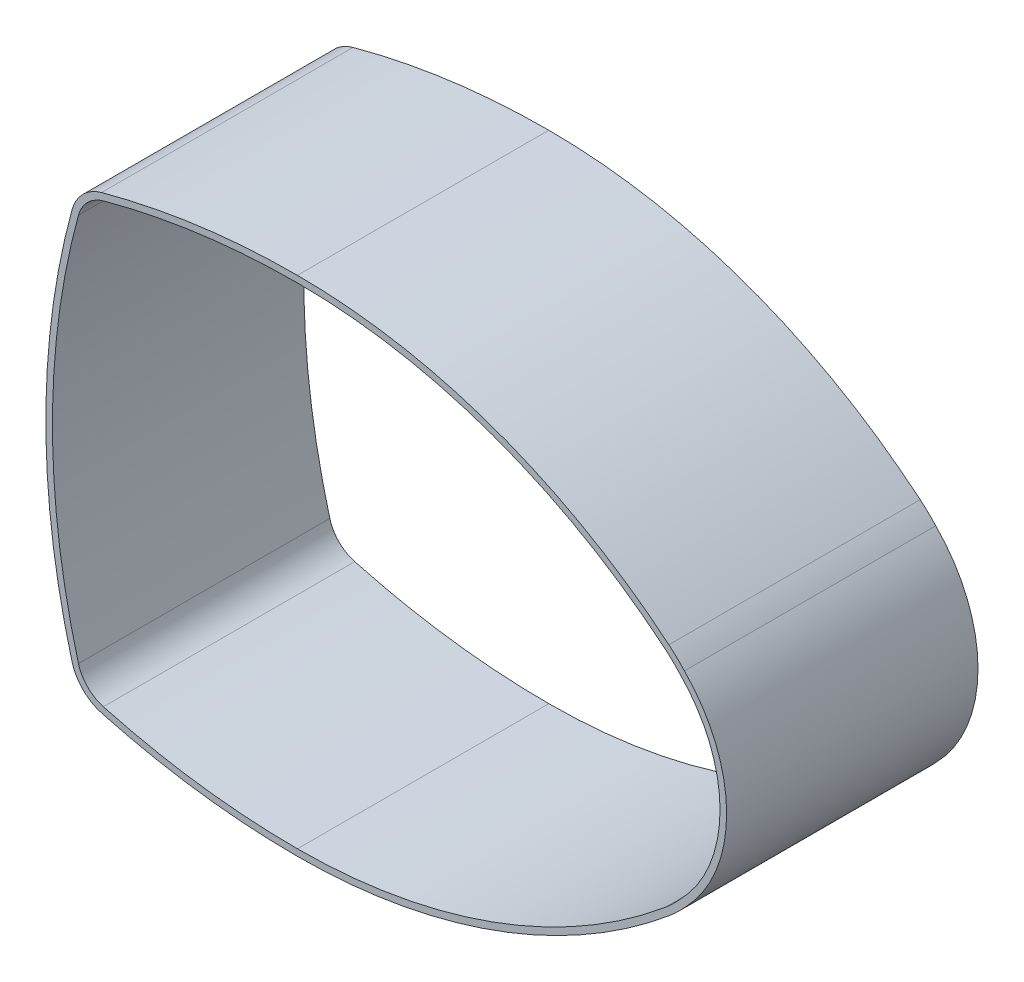
from build123d import *

# Parameters (mm, degrees)
EXTRUDE_1_DEPTH = 38.1


with BuildPart() as part:
    # Эскиз1 → Бобышка-Вытянуть1 (new body)
    with BuildSketch(Plane.XY):
        with BuildLine():
            ThreePointArc((58.039129224, 77.945655108), (56.901327597, 79.116004883), (55.683853915, 80.203234837))
            ThreePointArc((55.683853915, 80.203234837), (29.318529457, 95.307848832), (-0.611231214, 100.550855968))
            ThreePointArc((-0.611231214, 100.550855968), (-15.584507099, 99.552637576), (-30.292769251, 96.575649981))
            ThreePointArc((-30.292769251, 96.575649981), (-33.129887493, 94.929167254), (-34.776370221, 92.092049011))
            ThreePointArc((-34.776370221, 92.092049011), (-38.751576208, 62.410510975), (-34.776370221, 32.728972938))
            ThreePointArc((-34.776370221, 32.728972938), (-33.129887493, 29.891854696), (-30.29276925, 28.245371968))
            ThreePointArc((-30.29276925, 28.245371968), (-15.584507098, 25.268384374), (-0.611231214, 24.270165982))
            ThreePointArc((-0.611231214, 24.270165982), (29.318529457, 29.513173118), (55.683853915, 44.617787113))
            ThreePointArc((55.683853915, 44.617787113), (56.901327595, 45.705017068), (58.039129224, 46.875366842))
            ThreePointArc((58.039129224, 46.875366842), (64.442309074, 62.410510975), (58.039129224, 77.945655108))
        make_face()
        with BuildLine():
            ThreePointArc((57.313391253, 77.25728346), (63.442309074, 62.410510975), (57.313391253, 47.56373849))
            ThreePointArc((57.313391253, 47.56373849), (56.217638563, 46.434884922), (55.04449071, 45.386691978))
            ThreePointArc((55.04449071, 45.386691978), (28.978606573, 30.453626431), (-0.611231214, 25.270165982))
            ThreePointArc((-0.611231214, 25.270165982), (-15.451763735, 26.259534816), (-30.029631964, 29.210130367))
            ThreePointArc((-30.029631964, 29.210130367), (-32.422780711, 30.598961477), (-33.811611821, 32.992110224))
            ThreePointArc((-33.811611821, 32.992110224), (-37.751576208, 62.410510974), (-33.811611822, 91.828911725))
            ThreePointArc((-33.811611822, 91.828911725), (-32.422780712, 94.222060472), (-30.029631965, 95.610891582))
            ThreePointArc((-30.029631965, 95.610891582), (-15.451763736, 98.561487134), (-0.611231214, 99.550855968))
            ThreePointArc((-0.611231214, 99.550855968), (28.978606573, 94.367395519), (55.04449071, 79.434329972))
            ThreePointArc((55.04449071, 79.434329972), (56.217638563, 78.386137027), (57.313391253, 77.25728346))
        make_face(mode=Mode.SUBTRACT)
    extrude(amount=EXTRUDE_1_DEPTH)


solid = part.part
